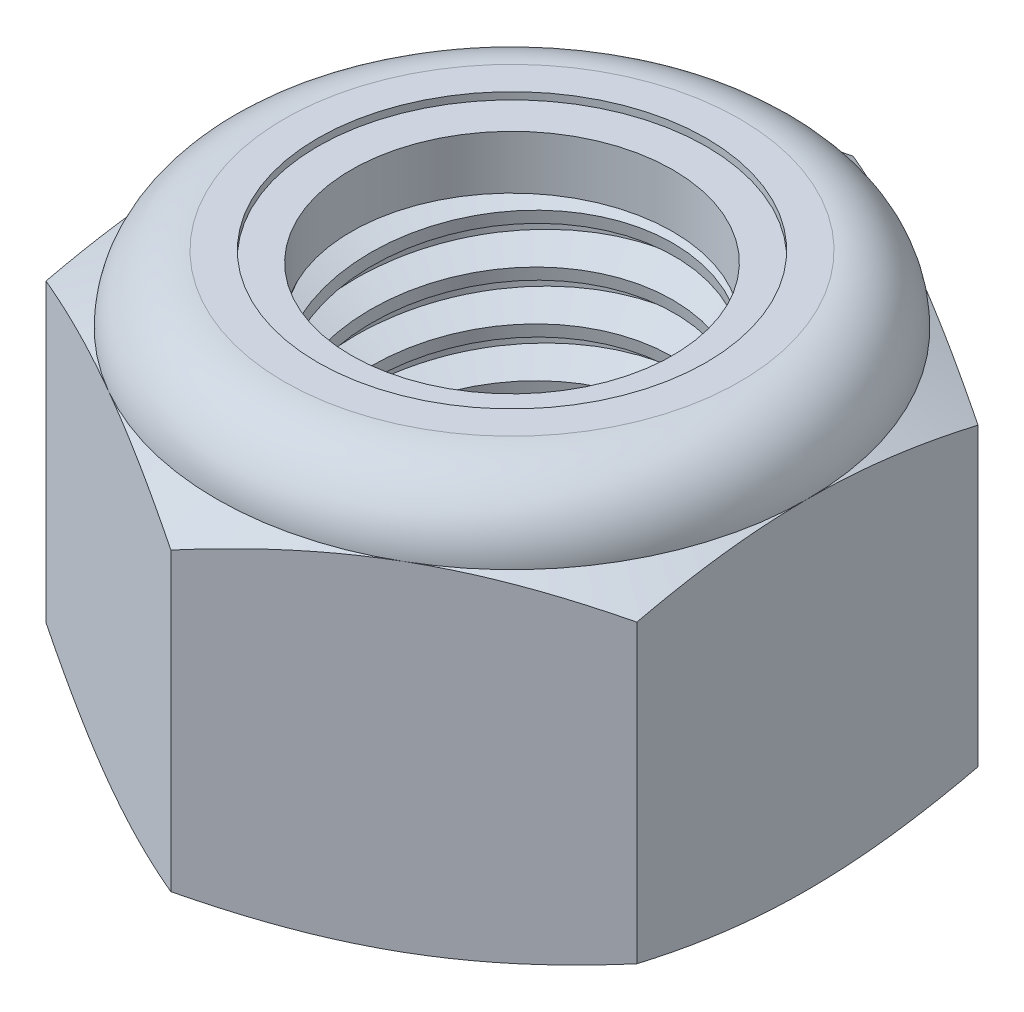
from build123d import *

# Parameters (mm, degrees)
EXTRUDE1_DEPTH      = 8.73125
SKETCH2_W           = 3.9624
SKETCH2_H           = 8.73125
LPATTERN1_COUNT     = 8
LPATTERN1_PITCH     = 1.058333333
LPATTERN1_COL_COUNT = 2
LPATTERN1_COL_PITCH = 1.058333333


with BuildPart() as part:
    # Sketch1 → Extrude1 (new body)
    with BuildSketch(Plane(origin=(0, 0, 0), x_dir=(1, 0, 0), z_dir=(0, 1, 0))):
        Polygon((0, 7.332348419), (-6.35, 3.666174209), (-6.35, -3.666174209), (0, -7.332348419), (6.35, -3.666174209), (6.35, 3.666174209), align=None)
    extrude(amount=EXTRUDE1_DEPTH)

    # Sketch4 → Cut-Revolve2 (revolve, cut)
    with BuildSketch(Plane(origin=(0, 0, 0), x_dir=(0, 0, -1), z_dir=(1, 0, 0)), mode=Mode.PRIVATE) as cut_revolve2_sk:
        Polygon((0, 8.73125), (3.9624, 8.73125), (3.4558921, 8.495061487), (3.4558921, 0.236188513), (3.9624, 0), (0, 0), align=None)
    revolve(cut_revolve2_sk.sketch.rotate(Axis((0, 8.73125, 0), (0, 1, 0)), 54.867789329), axis=Axis((0, 8.73125, 0), (0, 1, 0)), mode=Mode.SUBTRACT)


with BuildPart() as body_2:
    # Sketch2 → Revolve1 (revolve)
    with BuildSketch(Plane(origin=(0, 0, 0), x_dir=(0, 0, -1), z_dir=(1, 0, 0))):
        with Locations((1.9812, 4.365625)):
            Rectangle(SKETCH2_W, SKETCH2_H)
    revolve(axis=Axis((0, -3.9624, 0), (0, 1, 0)))

    # Sketch3 → Cut-Revolve1 (revolve, cut)
    with BuildSketch(Plane(origin=(0, 0, 0), x_dir=(0, 0, -1), z_dir=(1, 0, 0)), mode=Mode.PRIVATE) as cut_revolve1_sk:
        Polygon((3.979911688, 8.600122482), (4.102493502, 7.682229859), (3.490915476, 7.934220821), (3.4558921, 8.196475856), align=None)
    cut_revolve1 = revolve(cut_revolve1_sk.sketch.rotate(Axis((0, 8.73125, 0.150876649), (0, -0.9912001327823777, -0.13237181260448438)), 180), axis=Axis((0, 8.73125, 0.150876649), (0, -0.9912001327823777, -0.13237181260448438)), mode=Mode.SUBTRACT)

    # LPattern1: Cut-Revolve1 ×8
    with Locations(*[(0, -i * LPATTERN1_PITCH, 0) for i in range(1, LPATTERN1_COUNT)]):
        add(cut_revolve1, mode=Mode.SUBTRACT)

    # LPattern1 col: Cut-Revolve1 ×2
    with Locations(*[(0, i * LPATTERN1_COL_PITCH, 0) for i in range(1, LPATTERN1_COL_COUNT)]):
        add(cut_revolve1, mode=Mode.SUBTRACT)


with BuildPart() as part_1:
    add(part.part)

    # Combine1: cut body 2
    add(body_2.part, mode=Mode.SUBTRACT)

    # Sketch5 → Cut-Revolve3 (revolve, cut)
    with BuildSketch(Plane(origin=(0, 0, 0), x_dir=(0, 0, -1), z_dir=(1, 0, 0)), mode=Mode.PRIVATE) as cut_revolve3_sk:
        with BuildLine():
            Line((0, 0), (6.35, 0))
            Line((6.35, 0), (7.332348419, 0.458076591))
            Line((7.332348419, 0.458076591), (7.332348419, 6.817965076))
            Line((7.332348419, 6.817965076), (6.35, 7.276041667))
            ThreePointArc((6.35, 7.276041667), (5.923779347, 8.305029347), (4.894791667, 8.73125))
            Line((4.894791667, 8.73125), (4.894791667, 10.00125))
            Line((4.894791667, 10.00125), (8.602348419, 10.00125))
            Line((8.602348419, 10.00125), (8.602348419, -1.27))
            Line((8.602348419, -1.27), (0, -1.27))
            Line((0, -1.27), (0, 0))
        make_face()
    revolve(cut_revolve3_sk.sketch.rotate(Axis((0, 0, 0), (0, 1, 0)), 54.867789329), axis=Axis((0, 0, 0), (0, 1, 0)), mode=Mode.SUBTRACT)

    # Sketch6 → Cut-Revolve4 (revolve, cut)
    with BuildSketch(Plane(origin=(0, 0, 0), x_dir=(0, 0, -1), z_dir=(1, 0, 0)), mode=Mode.PRIVATE) as cut_revolve4_sk:
        with BuildLine():
            Line((0, 7.276041667), (6.1976, 7.276041667))
            ThreePointArc((6.1976, 7.276041667), (5.816016274, 8.197266274), (4.894791667, 8.57885))
            Line((4.894791667, 8.57885), (4.175341883, 8.57885))
            Line((4.175341883, 8.57885), (4.175341883, 10.00125))
            Line((4.175341883, 10.00125), (0, 10.00125))
            Line((0, 10.00125), (0, 7.276041667))
        make_face()
    revolve(cut_revolve4_sk.sketch.rotate(Axis((0, 10.00125, 0), (0, 1, 0)), 54.867789329), axis=Axis((0, 10.00125, 0), (0, 1, 0)), mode=Mode.SUBTRACT)


with BuildPart() as body_2_2:
    # Sketch7 → Revolve2 (revolve)
    with BuildSketch(Plane(origin=(0, 0, 0), x_dir=(0, 0, -1), z_dir=(1, 0, 0)), mode=Mode.PRIVATE) as revolve2_sk:
        with BuildLine():
            Line((3.4558921, 7.352241667), (6.119030844, 7.352241667))
            ThreePointArc((6.119030844, 7.352241667), (5.734762038, 8.169919611), (4.894791667, 8.50265))
            Line((4.894791667, 8.50265), (3.4558921, 8.50265))
            Line((3.4558921, 8.50265), (3.4558921, 7.352241667))
        make_face()
    revolve(revolve2_sk.sketch.rotate(Axis((0, 7.352241667, 0), (0, 1, 0)), 54.867789329), axis=Axis((0, 7.352241667, 0), (0, 1, 0)))


solid = Compound([part_1.part, body_2_2.part])
